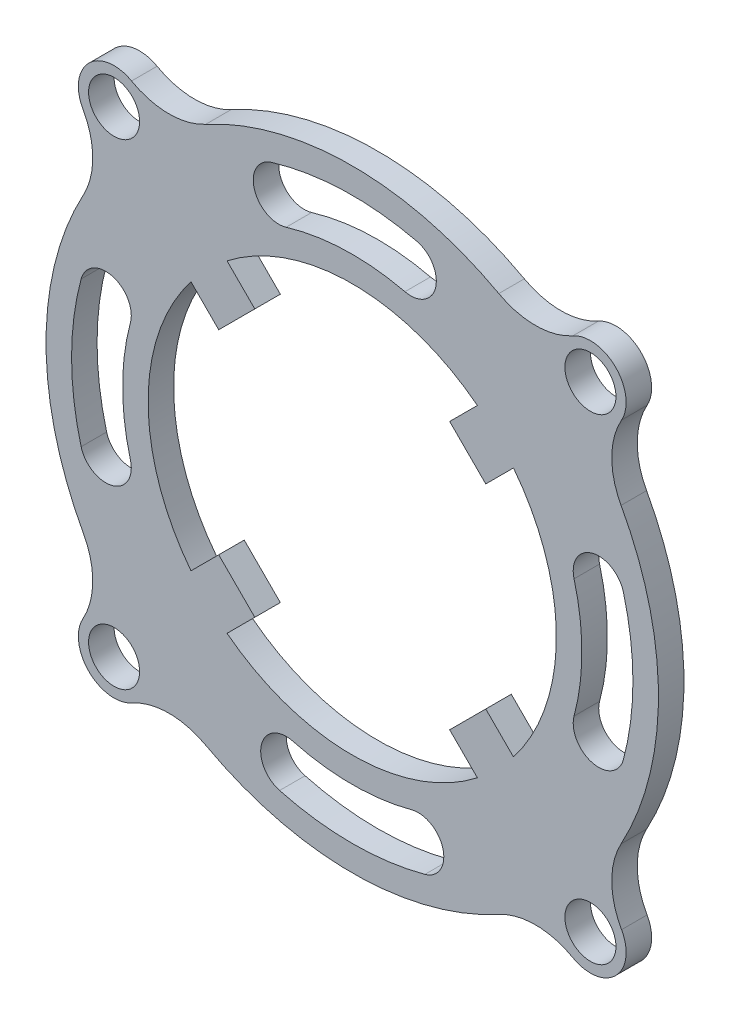
from build123d import *

# Parameters (mm, degrees)
ESBO_O1_R                = 120
ESBO_O1_R_2              = 80
RESSALTO_EXTRUS_O1_DEPTH = 10
CORTE_EXTRUS_O1_DEPTH    = 10
ESBO_O3_R                = 14
ESBO_O3_R_2              = 10
RESSALTO_EXTRUS_O2_DEPTH = 10
FILETE1_R                = 30
RESSALTO_EXTRUS_O3_START = -10
RESSALTO_EXTRUS_O3_DEPTH = 10


with BuildPart() as part:
    # Esboço1 → Ressalto-extrusão1 (new body)
    with BuildSketch(Plane.XY):
        Circle(ESBO_O1_R)
        Circle(ESBO_O1_R_2, mode=Mode.SUBTRACT)
    extrude(amount=RESSALTO_EXTRUS_O1_DEPTH)

    # Esboço2 → Corte-extrusão1 (cut)
    with BuildSketch(Plane.XY.offset(10)):
        with BuildLine():
            ThreePointArc((25.245684703, 107.063791283), (-3.324689368, 109.949745068), (-31.668491353, 105.342805428))
            ThreePointArc((-31.668491353, 105.342805428), (-38.366156269, 92.887232993), (-25.910583834, 86.189568077))
            ThreePointArc((-25.910583834, 86.189568077), (-2.720200392, 89.958882329), (20.655560211, 87.597647413))
            ThreePointArc((20.655560211, 87.597647413), (32.683694392, 95.035657102), (25.245684703, 107.063791283))
        make_face()
        with BuildLine():
            ThreePointArc((106.251840892, -28.470094961), (110, 0), (106.251840892, 28.470094961))
            ThreePointArc((106.251840892, 28.470094961), (94.004392178, 35.541162773), (86.933324366, 23.293714059))
            ThreePointArc((86.933324366, 23.293714059), (90, 0), (86.933324366, -23.293714059))
            ThreePointArc((86.933324366, -23.293714059), (94.004392178, -35.541162773), (106.251840892, -28.470094961))
        make_face()
        with BuildLine():
            ThreePointArc((-28.470094961, -106.251840892), (0, -110), (28.470094961, -106.251840892))
            ThreePointArc((28.470094961, -106.251840892), (35.541162773, -94.004392178), (23.293714059, -86.933324366))
            ThreePointArc((23.293714059, -86.933324366), (0, -90), (-23.293714059, -86.933324366))
            ThreePointArc((-23.293714059, -86.933324366), (-35.541162773, -94.004392178), (-28.470094961, -106.251840892))
        make_face()
        with BuildLine():
            ThreePointArc((-106.251840892, 28.470094961), (-110, 0), (-106.251840892, -28.470094961))
            ThreePointArc((-106.251840892, -28.470094961), (-94.004392178, -35.541162773), (-86.933324366, -23.293714059))
            ThreePointArc((-86.933324366, -23.293714059), (-90, 0), (-86.933324366, 23.293714059))
            ThreePointArc((-86.933324366, 23.293714059), (-94.004392178, 35.541162773), (-106.251840892, 28.470094961))
        make_face()
    extrude(amount=-CORTE_EXTRUS_O1_DEPTH, mode=Mode.SUBTRACT)

    # Esboço3 → Ressalto-extrusão2 (add)
    # profile 1 of 4: a face of its own
    with BuildSketch(Plane.XY.offset(10)):
        with Locations((93.338095117, 93.338095117)):
            Circle(ESBO_O3_R)
        with Locations((93.338095117, 93.338095117)):
            Circle(ESBO_O3_R_2, mode=Mode.SUBTRACT)
    # profile 2 of 4: a face of its own
    with BuildSketch(Plane.XY.offset(10)):
        with Locations((93.338095117, -93.338095117)):
            Circle(ESBO_O3_R)
        with Locations((93.338095117, -93.338095117)):
            Circle(ESBO_O3_R_2, mode=Mode.SUBTRACT)
    # profile 3 of 4: a face of its own
    with BuildSketch(Plane.XY.offset(10)):
        with Locations((-93.338095117, -93.338095117)):
            Circle(ESBO_O3_R)
        with Locations((-93.338095117, -93.338095117)):
            Circle(ESBO_O3_R_2, mode=Mode.SUBTRACT)
    # profile 4 of 4: a face of its own
    with BuildSketch(Plane.XY.offset(10)):
        with Locations((-93.338095117, 93.338095117)):
            Circle(ESBO_O3_R)
        with Locations((-93.338095117, 93.338095117)):
            Circle(ESBO_O3_R_2, mode=Mode.SUBTRACT)
    extrude(amount=-RESSALTO_EXTRUS_O2_DEPTH)

    # Filete1
    filete1_edges = [part.edges().sort_by_distance(p)[0] for p in [
        (-89.573264047, -79.853806221, 5),
        (-79.853806221, -89.573264047, 5),
        (-79.853806221, 89.573264047, 5),
        (-89.573264047, 79.853806221, 5),
        (79.853806221, 89.573264047, 5),
        (89.573264047, 79.853806221, 5),
        (89.573264047, -79.853806221, 5),
        (79.853806221, -89.573264047, 5),
    ]]
    fillet(filete1_edges, radius=FILETE1_R)

    # Esboço4 → Ressalto-extrusão3 (add)
    with BuildSketch(Plane.XY.offset(10).offset(RESSALTO_EXTRUS_O3_START)):
        with BuildLine():
            Line((52.325901808, -38.183766184), (38.183766184, -52.325901808))
            Line((38.183766184, -52.325901808), (49.05379299, -63.195928613))
            ThreePointArc((49.05379299, -63.195928613), (56.568542495, -56.568542495), (63.195928613, -49.05379299))
            Line((63.195928613, -49.05379299), (52.325901808, -38.183766184))
        make_face()
        with BuildLine():
            Line((-38.183766184, -52.325901808), (-52.325901808, -38.183766184))
            Line((-52.325901808, -38.183766184), (-63.195928613, -49.05379299))
            ThreePointArc((-63.195928613, -49.05379299), (-56.568542495, -56.568542495), (-49.05379299, -63.195928613))
            Line((-49.05379299, -63.195928613), (-38.183766184, -52.325901808))
        make_face()
        with BuildLine():
            Line((38.183766184, 52.325901808), (52.325901808, 38.183766184))
            Line((52.325901808, 38.183766184), (63.195928613, 49.05379299))
            ThreePointArc((63.195928613, 49.05379299), (56.568542495, 56.568542495), (49.05379299, 63.195928613))
            Line((49.05379299, 63.195928613), (38.183766184, 52.325901808))
        make_face()
        with BuildLine():
            Line((-52.325901808, 38.183766184), (-38.183766184, 52.325901808))
            Line((-38.183766184, 52.325901808), (-49.05379299, 63.195928613))
            ThreePointArc((-49.05379299, 63.195928613), (-56.568542495, 56.568542495), (-63.195928613, 49.05379299))
            Line((-63.195928613, 49.05379299), (-52.325901808, 38.183766184))
        make_face()
    extrude(amount=RESSALTO_EXTRUS_O3_DEPTH)


solid = part.part
